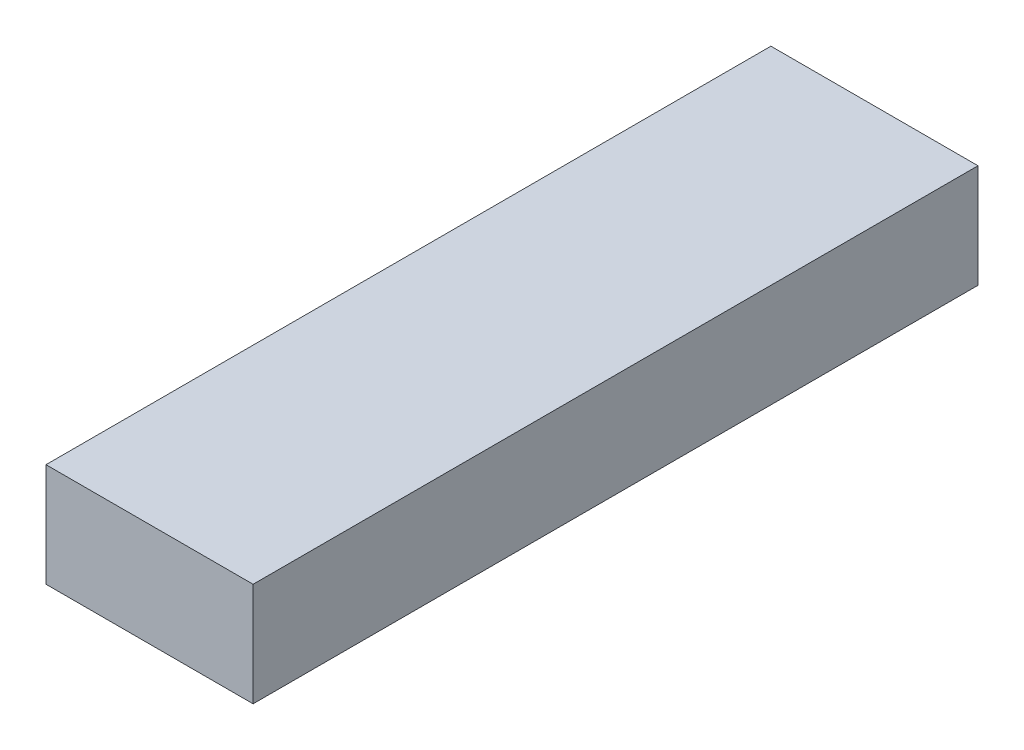
from build123d import *

# Parameters (mm, degrees)
SKETCH1_W           = 50.8
SKETCH1_H           = 25.4
BOSS_EXTRUDE1_DEPTH = 177.8


with BuildPart() as part:
    # Sketch1 → Boss-Extrude1 (new body)
    with BuildSketch(Plane.XY):
        Rectangle(SKETCH1_W, SKETCH1_H)
    extrude(amount=BOSS_EXTRUDE1_DEPTH)


solid = part.part
